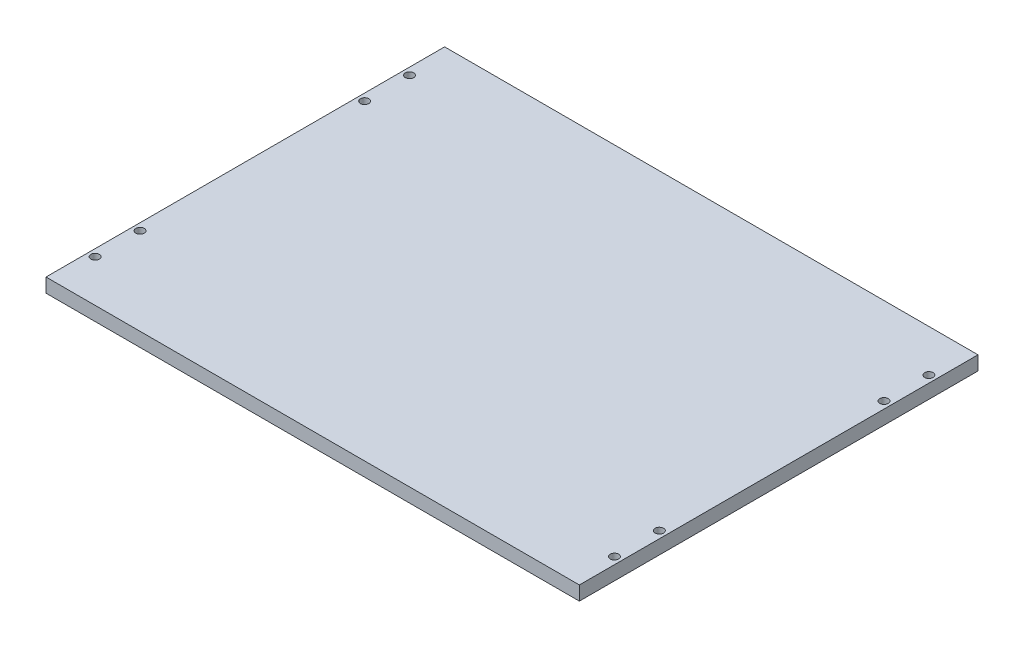
from build123d import *

# Parameters (mm, degrees)
SKETCH1_W           = 95
SKETCH1_H           = 142
SKETCH1_R           = 1.5
BOSS_EXTRUDE1_DEPTH = 5


with BuildPart() as part:
    # Sketch1 → Boss-Extrude1 (new body)
    with BuildSketch(Plane(origin=(0, 0, 0), x_dir=(1, 0, 0), z_dir=(0, 1, 0))):
        with Locations((47.5, 71)):
            Rectangle(SKETCH1_W, SKETCH1_H)
        with Locations(Location((92.5, 15, 0), (0, 0, 270))):
            Circle(SKETCH1_R, mode=Mode.SUBTRACT)
        with Locations(Location((92.5, 31, 0), (0, 0, 270))):
            Circle(SKETCH1_R, mode=Mode.SUBTRACT)
        with Locations(Location((92.5, 127, 0), (0, 0, 270))):
            Circle(SKETCH1_R, mode=Mode.SUBTRACT)
        with Locations(Location((92.5, 111, 0), (0, 0, 270))):
            Circle(SKETCH1_R, mode=Mode.SUBTRACT)
    boss_extrude1 = extrude(amount=BOSS_EXTRUDE1_DEPTH)

    # Mirror1: Boss-Extrude1 across plane
    add(boss_extrude1.mirror(Plane(origin=(0, 5, 0), x_dir=(0, 0, 1), z_dir=(1, 0, 0))))


solid = part.part
